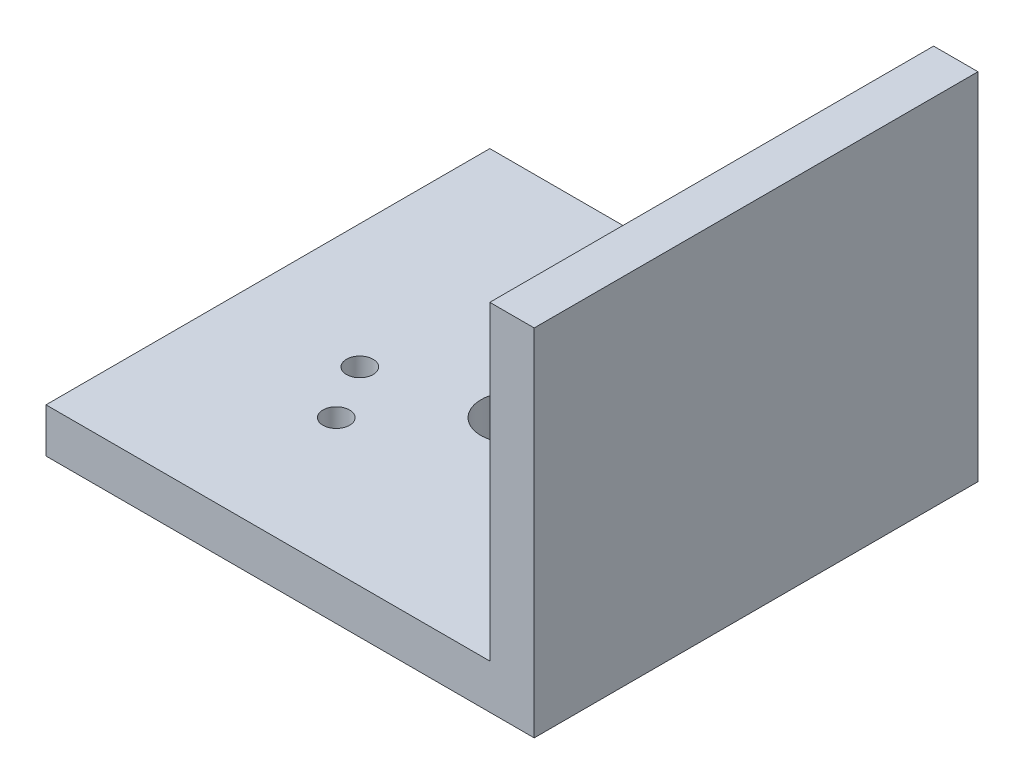
from build123d import *

# Parameters (mm, degrees)
BOSS_EXTRUDE1_DEPTH = 25
SKETCH2_R           = 3.5
SKETCH2_R_2         = 1.5
CUT_EXTRUDE1_DEPTH  = 52.051444642
CIRPATTERN1_COUNT   = 3


with BuildPart() as part:
    # Sketch1 → Boss-Extrude1 (new, symmetric)
    with BuildSketch(Plane.XY):
        Polygon((22.5, -2.5), (-27.5, -2.5), (-27.5, 2.5), (22.5, 2.5), (22.5, 37.5), (27.5, 37.5), (27.5, -2.5), align=None)
    extrude(amount=BOSS_EXTRUDE1_DEPTH, both=True)

    # Sketch2 → Cut-Extrude1 (cut, through all)
    with BuildSketch(Plane(origin=(0, 2.5, 0), x_dir=(1, 0, 0), z_dir=(0, 1, 0))):
        with Locations(Location((0, 0, 0), (0, 0, 180))):
            Circle(SKETCH2_R)
        with Locations(Location((-3.623466631, 13.522961568, 0), (0, 0, 180))):
            Circle(SKETCH2_R_2)
        with Locations((3.623466631, 13.522961568)):
            Circle(SKETCH2_R_2)
    cut_extrude1 = extrude(amount=-CUT_EXTRUDE1_DEPTH, mode=Mode.SUBTRACT)

    # CirPattern1: Cut-Extrude1 ×3 about axis
    cirpattern1_axis = Axis((0, 0, 0), (0, 1, 0))
    for i in range(1, CIRPATTERN1_COUNT):
        add(cut_extrude1.rotate(cirpattern1_axis, i * 360 / CIRPATTERN1_COUNT), mode=Mode.SUBTRACT)


solid = part.part
